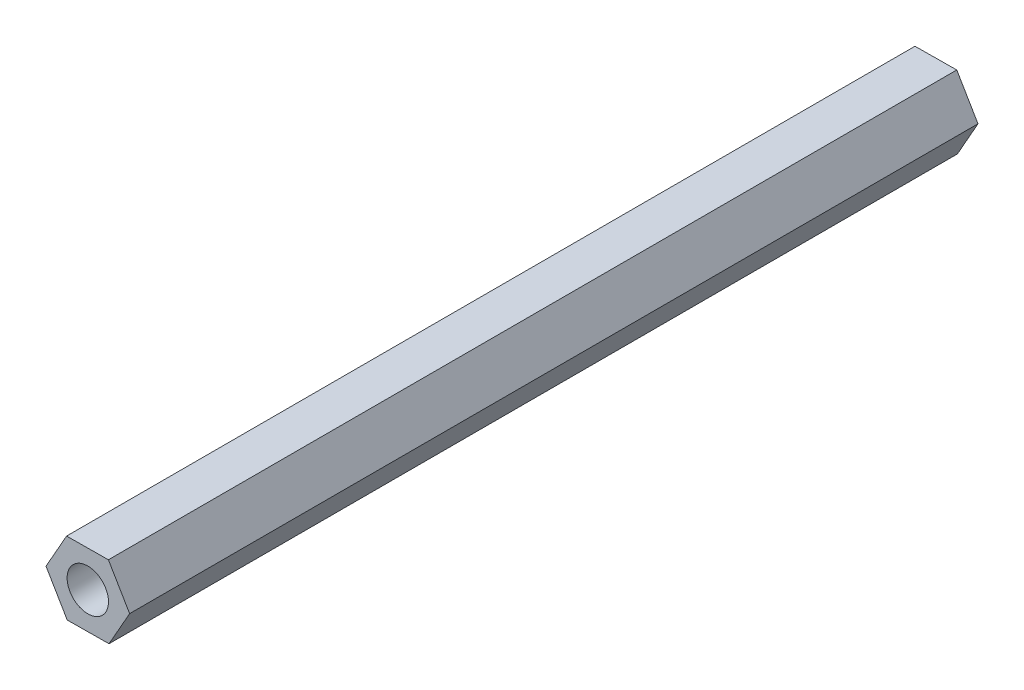
from build123d import *

# Parameters (mm, degrees)
SKETCH_1_R      = 2
EXTRUDE_1_DEPTH = 82


with BuildPart() as part:
    # 草图1 → 凸台-拉伸1 (new body)
    with BuildSketch(Plane.XY):
        Polygon((2.051456248, -3.482077052), (4.041295309, 0.035574699), (1.989839061, 3.517651751), (-2.051456248, 3.482077052), (-4.041295309, -0.035574699), (-1.989839061, -3.517651751), align=None)
        Circle(SKETCH_1_R, mode=Mode.SUBTRACT)
    extrude(amount=EXTRUDE_1_DEPTH)


solid = part.part
